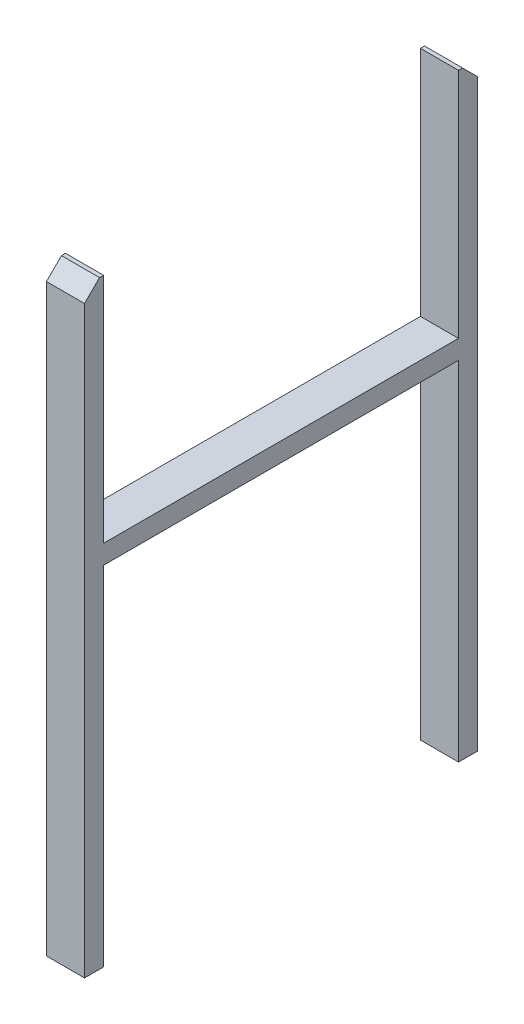
from build123d import *

# Parameters (mm, degrees)
CROQUIS2_W                = 50.8
CROQUIS2_H                = 25.4
SALIENTE_EXTRUIR1_DEPTH   = 800
SALIENTE_EXTRUIR1_2_DEPTH = 800
CROQUIS3_W                = 50.8
CROQUIS3_H                = 25.4
SALIENTE_EXTRUIR2_DEPTH   = 474
CHAFL_N1_SIZE             = 20


with BuildPart() as part:
    # Croquis2 → Saliente-Extruir1 (new body)
    with BuildSketch(Plane(origin=(0, 0, 0), x_dir=(1, 0, 0), z_dir=(0, 1, 0))):
        with Locations((25.4, -12.7)):
            Rectangle(CROQUIS2_W, CROQUIS2_H)
    extrude(amount=SALIENTE_EXTRUIR1_DEPTH)



with BuildPart() as body_2:
    # Croquis2 → Saliente-Extruir1 2 (new body)
    with BuildSketch(Plane(origin=(0, 0, 0), x_dir=(1, 0, 0), z_dir=(0, 1, 0))):
        with Locations((25.4, 486.7)):
            Rectangle(CROQUIS2_W, CROQUIS2_H)
    extrude(amount=SALIENTE_EXTRUIR1_2_DEPTH)


with BuildPart() as part_1:
    add(part.part)

    add(body_2.part)  # Saliente-Extruir2 merges body 2
    # Croquis3 → Saliente-Extruir2 (add)
    with BuildSketch(Plane.XY.offset(-474)):
        with Locations((25.4, 477.3)):
            Rectangle(CROQUIS3_W, CROQUIS3_H)
    extrude(amount=SALIENTE_EXTRUIR2_DEPTH)

    # Chaflán1
    chafl_n1_edges = [part_1.edges().sort_by_distance(p)[0] for p in [
        (25.4, 800, 25.4),
        (25.4, 800, -499.4),
    ]]
    chamfer(chafl_n1_edges, length=CHAFL_N1_SIZE)


solid = part_1.part
